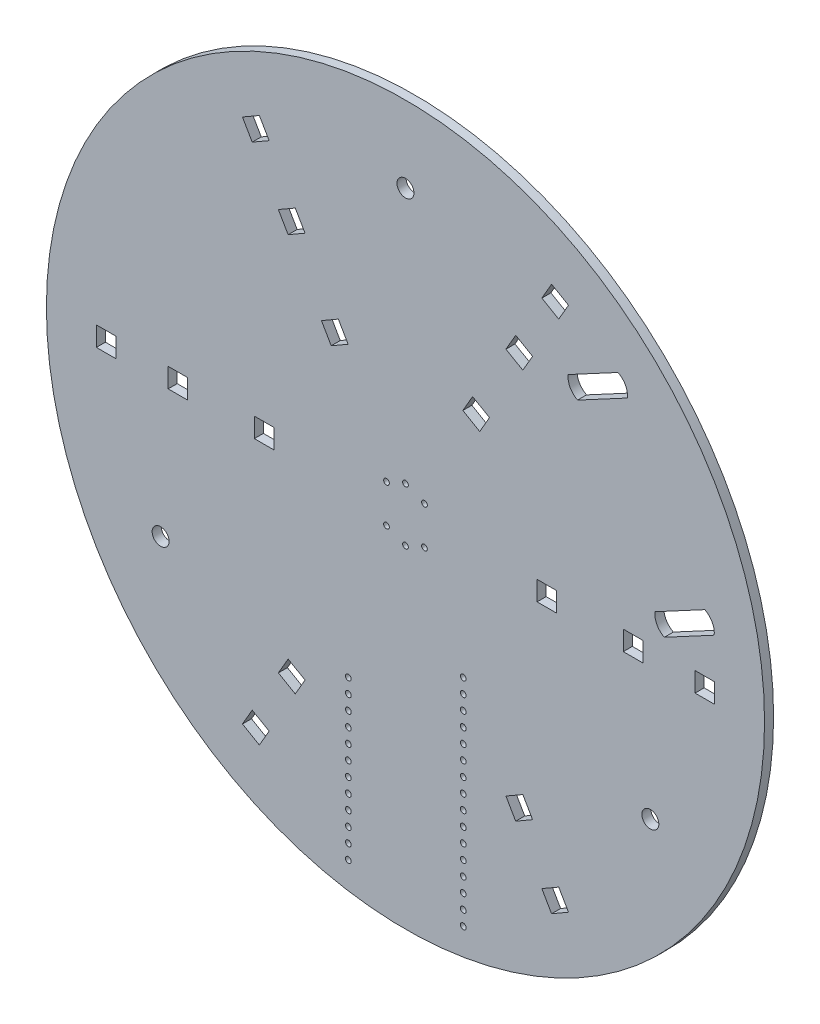
from build123d import *

# Parameters (mm, degrees)
SKETCH1_R           = 63.5
BOSS_EXTRUDE1_DEPTH = 1.6
SKETCH3_R           = 1.75
CUT_EXTRUDE4_DEPTH  = 1.6
SKETCH2_R           = 1.5
CUT_EXTRUDE5_DEPTH  = 1.6
CUT_EXTRUDE6_DEPTH  = 10
SKETCH5_R           = 0.508001015
SKETCH5_W           = 3.45
SKETCH5_H           = 3.45
CUT_EXTRUDE7_DEPTH  = 10
SKETCH6_R           = 0.5
CUT_EXTRUDE8_DEPTH  = 10


with BuildPart() as part:
    # Sketch1 → Boss-Extrude1 (new body)
    with BuildSketch(Plane.XY):
        Circle(SKETCH1_R)
    extrude(amount=BOSS_EXTRUDE1_DEPTH)

    # Sketch3 → Cut-Extrude4 (cut)
    with BuildSketch(Plane(origin=(0, 0, 0), x_dir=(-1, 0, 0), z_dir=(0, 0, -1))):
        with Locations((-34.006305458, 36.654756705)):
            Circle(SKETCH3_R)
        with Locations((-49.354669589, 8.007283544)):
            Circle(SKETCH3_R)
    extrude(amount=-CUT_EXTRUDE4_DEPTH, mode=Mode.SUBTRACT)

    # Sketch2 → Cut-Extrude5 (cut)
    with BuildSketch(Plane(origin=(0, 0, 0), x_dir=(-1, 0, 0), z_dir=(0, 0, -1))):
        with Locations((0, 50)):
            Circle(SKETCH2_R)
        with Locations((43.301270189, -25)):
            Circle(SKETCH2_R)
        with Locations((-43.301270189, -25)):
            Circle(SKETCH2_R)
    extrude(amount=-CUT_EXTRUDE5_DEPTH, mode=Mode.SUBTRACT)

    # Sketch4 → Cut-Extrude6 (cut)
    with BuildSketch(Plane(origin=(0, 0, 0), x_dir=(-1, 0, 0), z_dir=(0, 0, -1))):
        with BuildLine():
            Line((-52.935522776, 11.911126581), (-44.12091565, 7.188553002))
            ThreePointArc((-44.12091565, 7.188553002), (-44.461118004, 5.385481223), (-45.773816402, 4.103440508))
            Line((-45.773816402, 4.103440508), (-54.588423529, 8.826014086))
            ThreePointArc((-54.588423529, 8.826014086), (-54.248221174, 10.629085865), (-52.935522776, 11.911126581))
        make_face()
        with BuildLine():
            Line((-39.240059397, 37.473487247), (-30.425452271, 32.750913668))
            ThreePointArc((-30.425452271, 32.750913668), (-29.112753873, 34.032954384), (-28.772551518, 35.836026163))
            Line((-28.772551518, 35.836026163), (-37.587158645, 40.558599742))
            ThreePointArc((-37.587158645, 40.558599742), (-38.899857043, 39.276559026), (-39.240059397, 37.473487247))
        make_face()
    extrude(amount=-CUT_EXTRUDE6_DEPTH, mode=Mode.SUBTRACT)

    # Sketch5 → Cut-Extrude7 (cut)
    with BuildSketch(Plane(origin=(0, 0, 0), x_dir=(-1, 0, 0), z_dir=(0, 0, -1))):
        with Locations((-10.219411384, -19.83547506)):
            Circle(SKETCH5_R)
        with Locations((-10.219411384, -22.37547506)):
            Circle(SKETCH5_R)
        with Locations((-10.219411384, -24.91547506)):
            Circle(SKETCH5_R)
        with Locations((-10.219411384, -27.45547506)):
            Circle(SKETCH5_R)
        with Locations((-10.219411384, -29.99547506)):
            Circle(SKETCH5_R)
        with Locations((-10.219411384, -32.53547506)):
            Circle(SKETCH5_R)
        with Locations((-10.219411384, -35.07547506)):
            Circle(SKETCH5_R)
        with Locations((-10.219411384, -37.61547506)):
            Circle(SKETCH5_R)
        with Locations((-10.219411384, -40.15547506)):
            Circle(SKETCH5_R)
        with Locations((-10.219411384, -42.69547506)):
            Circle(SKETCH5_R)
        with Locations((-10.219411384, -45.23547506)):
            Circle(SKETCH5_R)
        with Locations((-10.219411384, -47.77547506)):
            Circle(SKETCH5_R)
        with Locations((-10.219411384, -50.31547506)):
            Circle(SKETCH5_R)
        with Locations((-10.219411384, -52.85547506)):
            Circle(SKETCH5_R)
        with Locations((-10.219411384, -55.39547506)):
            Circle(SKETCH5_R)
        with Locations((-10.219411384, -57.93547506)):
            Circle(SKETCH5_R)
        with Locations((10.100588616, -57.93547506)):
            Circle(SKETCH5_R)
        with Locations((10.100588616, -55.39547506)):
            Circle(SKETCH5_R)
        with Locations((10.100588616, -52.85547506)):
            Circle(SKETCH5_R)
        with Locations((10.100588616, -50.31547506)):
            Circle(SKETCH5_R)
        with Locations((10.100588616, -47.77547506)):
            Circle(SKETCH5_R)
        with Locations((10.100588616, -45.23547506)):
            Circle(SKETCH5_R)
        with Locations((10.100588616, -42.69547506)):
            Circle(SKETCH5_R)
        with Locations((10.100588616, -40.15547506)):
            Circle(SKETCH5_R)
        with Locations((10.100588616, -37.61547506)):
            Circle(SKETCH5_R)
        with Locations((10.100588616, -29.99547506)):
            Circle(SKETCH5_R)
        with Locations((10.100588616, -32.53547506)):
            Circle(SKETCH5_R)
        with Locations((10.100588616, -35.07547506)):
            Circle(SKETCH5_R)
        Polygon((-14.856393822, 22.282028916), (-11.868606178, 24.007028916), (-10.143606178, 21.019241273), (-13.131393822, 19.294241273), align=None)
        with Locations((-25, 0)):
            Rectangle(SKETCH5_W, SKETCH5_H)
        with Locations((-40.24, 0)):
            Rectangle(SKETCH5_W, SKETCH5_H)
        with Locations((-52.94, 0)):
            Rectangle(SKETCH5_W, SKETCH5_H)
        Polygon((-22.476393822, 35.48025607), (-19.488606178, 37.20525607), (-17.763606178, 34.217468427), (-20.751393822, 32.492468427), align=None)
        Polygon((-28.826393822, 46.478778698), (-25.838606178, 48.203778698), (-24.113606178, 45.215991055), (-27.101393822, 43.490991055), align=None)
        Polygon((11.868606178, 24.007028916), (14.856393822, 22.282028916), (13.131393822, 19.294241273), (10.143606178, 21.019241273), align=None)
        Polygon((19.488606178, 37.20525607), (22.476393822, 35.48025607), (20.751393822, 32.492468427), (17.763606178, 34.217468427), align=None)
        Polygon((25.838606178, 48.203778698), (28.826393822, 46.478778698), (27.101393822, 43.490991055), (24.113606178, 45.215991055), align=None)
        with Locations((25, 0)):
            Rectangle(SKETCH5_W, SKETCH5_H)
        with Locations((40.24, 0)):
            Rectangle(SKETCH5_W, SKETCH5_H)
        with Locations((52.94, 0)):
            Rectangle(SKETCH5_W, SKETCH5_H)
        Polygon((22.476393822, -35.48025607), (19.488606178, -37.20525607), (17.763606178, -34.217468427), (20.751393822, -32.492468427), align=None)
        Polygon((28.826393822, -46.478778698), (25.838606178, -48.203778698), (24.113606178, -45.215991055), (27.101393822, -43.490991055), align=None)
        Polygon((-19.488606178, -37.20525607), (-22.476393822, -35.48025607), (-20.751393822, -32.492468427), (-17.763606178, -34.217468427), align=None)
        Polygon((-25.838606178, -48.203778698), (-28.826393822, -46.478778698), (-27.101393822, -43.490991055), (-24.113606178, -45.215991055), align=None)
    extrude(amount=-CUT_EXTRUDE7_DEPTH, mode=Mode.SUBTRACT)

    # Sketch6 → Cut-Extrude8 (cut)
    with BuildSketch(Plane(origin=(0, 0, 0), x_dir=(-1, 0, 0), z_dir=(0, 0, -1))):
        with Locations((0, 4.75)):
            Circle(SKETCH6_R)
        with Locations((-3.358757211, 3.358757211)):
            Circle(SKETCH6_R)
        with Locations((3.358757211, 3.358757211)):
            Circle(SKETCH6_R)
        with Locations(Location((3.358757211, -3.358757211, 0), (0, 0, 180))):
            Circle(SKETCH6_R)
        with Locations(Location((0, -4.75, 0), (0, 0, 180))):
            Circle(SKETCH6_R)
        with Locations(Location((-3.358757211, -3.358757211, 0), (0, 0, 180))):
            Circle(SKETCH6_R)
    extrude(amount=-CUT_EXTRUDE8_DEPTH, mode=Mode.SUBTRACT)


solid = part.part
